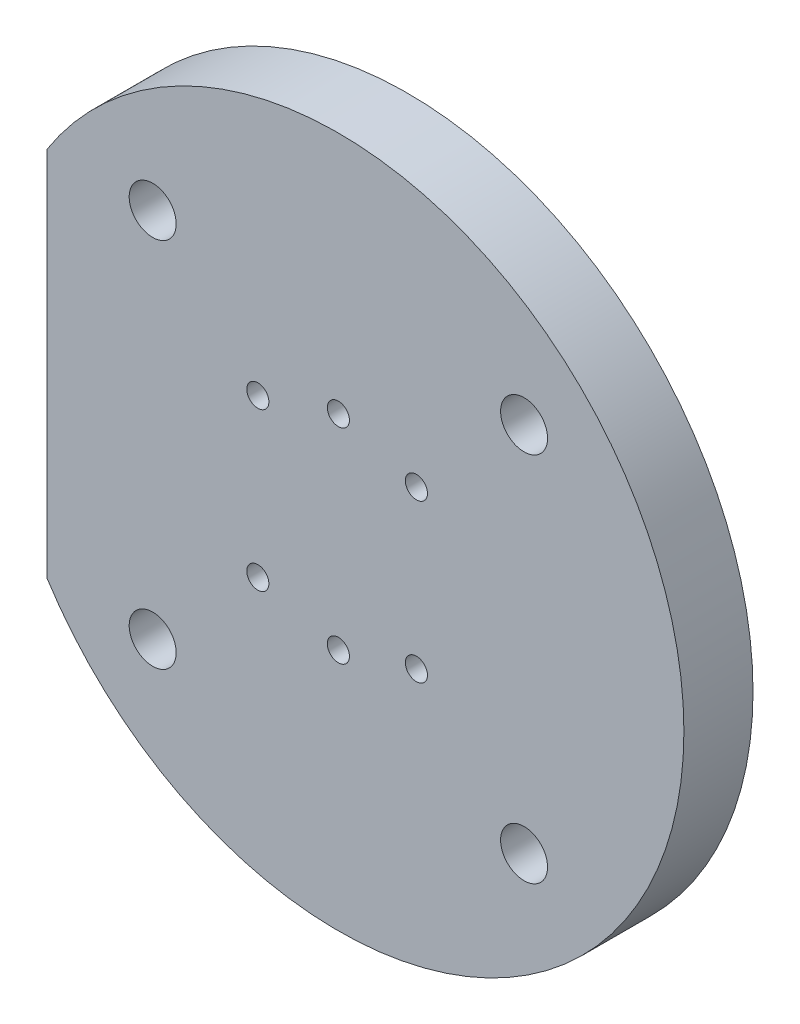
from build123d import *

# Parameters (mm, degrees)
ESQUISSE1_R             = 25
ESQUISSE1_R_2           = 1.7
BOSS_EXTRU_1_DEPTH      = 5
ESQUISSE11_R            = 0.8
ENL_V_MAT_EXTRU_1_DEPTH = 36.707142143
ESQUISSE13_W            = 4.903660669
ESQUISSE13_H            = 28.894120166
ENL_V_MAT_EXTRU_2_DEPTH = 36.707142143


with BuildPart() as part:
    # Esquisse1 → Boss.-Extru.1 (new body)
    with BuildSketch(Plane.XY):
        Circle(ESQUISSE1_R)
        with Locations((-13.435028843, 13.435028843)):
            Circle(ESQUISSE1_R_2, mode=Mode.SUBTRACT)
        with Locations((13.435028843, 13.435028843)):
            Circle(ESQUISSE1_R_2, mode=Mode.SUBTRACT)
        with Locations((13.435028843, -13.435028843)):
            Circle(ESQUISSE1_R_2, mode=Mode.SUBTRACT)
        with Locations((-13.435028843, -13.435028843)):
            Circle(ESQUISSE1_R_2, mode=Mode.SUBTRACT)
    extrude(amount=BOSS_EXTRU_1_DEPTH)

    # Esquisse11 → Enlèv. mat.-Extru.1 (cut, through all)
    with BuildSketch(Plane(origin=(0, 0, 0), x_dir=(-1, 0, 0), z_dir=(0, 0, -1))):
        with Locations((0, 7.398882196)):
            Circle(ESQUISSE11_R)
        with Locations((5.827506735, 5.634287936)):
            Circle(ESQUISSE11_R)
        with Locations((5.827506735, -5.758693792)):
            Circle(ESQUISSE11_R)
        with Locations((0, -7.398882196)):
            Circle(ESQUISSE11_R)
        with Locations((-5.645080413, -5.758693792)):
            Circle(ESQUISSE11_R)
        with Locations((-5.645080413, 5.634287936)):
            Circle(ESQUISSE11_R)
    extrude(amount=-ENL_V_MAT_EXTRU_1_DEPTH, mode=Mode.SUBTRACT)

    # Esquisse13 → Enlèv. mat.-Extru.2 (cut, through all)
    with BuildSketch(Plane(origin=(0, 0, 0), x_dir=(-1, 0, 0), z_dir=(0, 0, -1))):
        with Locations((23.534998976, -1.01203124)):
            Rectangle(ESQUISSE13_W, ESQUISSE13_H)
    extrude(amount=-ENL_V_MAT_EXTRU_2_DEPTH, mode=Mode.SUBTRACT)


solid = part.part
